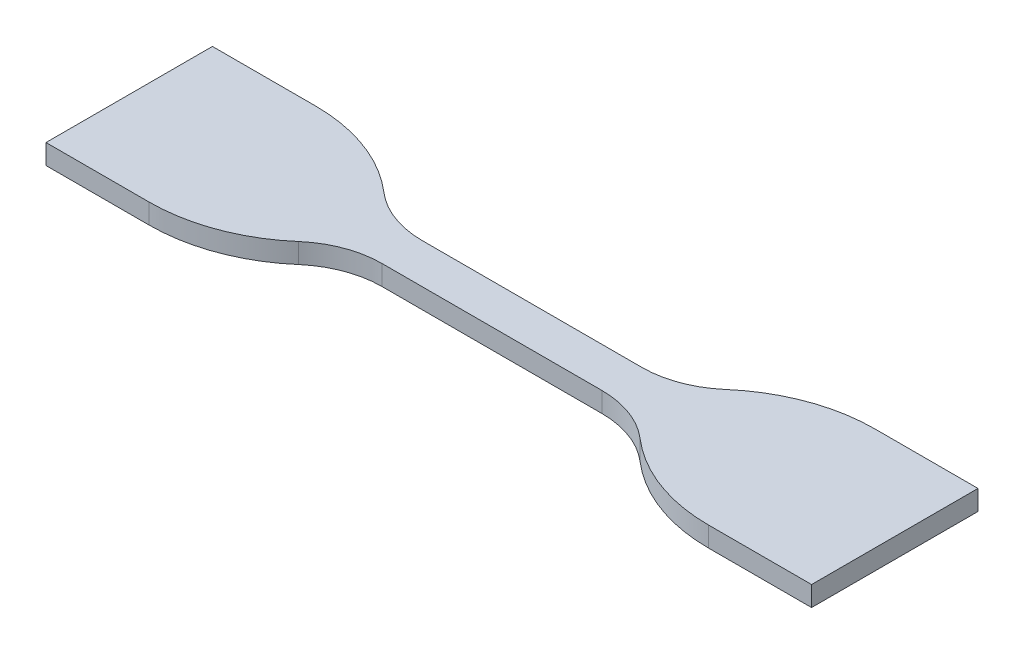
from build123d import *

# Parameters (mm, degrees)
BOSS_EXTRUDE1_DEPTH                      = 1.5
MIRROR1_AT_THE_SECOND_PLANE_COPY_1_DEPTH = 1.5
SCALE1_SCALE                             = 0.5


with BuildPart() as part:
    # Sketch1 → Boss-Extrude1 (new, symmetric)
    with BuildSketch(Plane(origin=(0, 0, 0), x_dir=(1, 0, 0), z_dir=(0, 1, 0))):
        with BuildLine():
            Line((0, 3), (16.5, 3))
            ThreePointArc((16.5, 3), (21.385877083, 3.880236087), (25.657364834, 6.41025641))
            ThreePointArc((25.657364834, 6.41025641), (33.285021532, 10.928149844), (42.009802038, 12.5))
            Line((42.009802038, 12.5), (57.5, 12.5))
            Line((57.5, 12.5), (57.5, 0))
            Line((57.5, 0), (0, 0))
            Line((0, 0), (0, 3))
        make_face()
    boss_extrude1 = extrude(amount=BOSS_EXTRUDE1_DEPTH, both=True)



with BuildPart() as mirror1_1:
    # Mirror1: Boss-Extrude1 across plane
    add(boss_extrude1.mirror(Plane(origin=(0, 0, 0), x_dir=(0, 0, 1), z_dir=(1, 0, 0))))


with BuildPart() as part_1:
    add(part.part)

    add(mirror1_1.part)  # Mirror1 at the second plane merges Mirror1_1
    # Mirror1 at the second plane: Boss-Extrude1 across plane
    add(boss_extrude1.mirror(Plane.XY))

    # Mirror1 at the second plane copy 1 sketc → Mirror1 at the second plane copy 1 (add, symmetric)
    with BuildSketch(Plane(origin=(0, 0, 0), x_dir=(-1, 0, 0), z_dir=(0, 1, 0))):
        with BuildLine():
            Line((0, 3), (16.5, 3))
            ThreePointArc((16.5, 3), (21.385877083, 3.880236087), (25.657364834, 6.41025641))
            ThreePointArc((25.657364834, 6.41025641), (33.285021532, 10.928149844), (42.009802038, 12.5))
            Line((42.009802038, 12.5), (57.5, 12.5))
            Line((57.5, 12.5), (57.5, 0))
            Line((57.5, 0), (0, 0))
            Line((0, 0), (0, 3))
        make_face()
    extrude(amount=MIRROR1_AT_THE_SECOND_PLANE_COPY_1_DEPTH, both=True)


with BuildPart() as part_2:
    # Scale1: scaled about (0, 0, 0)
    add(part_1.part.scale(SCALE1_SCALE))


solid = part_2.part
